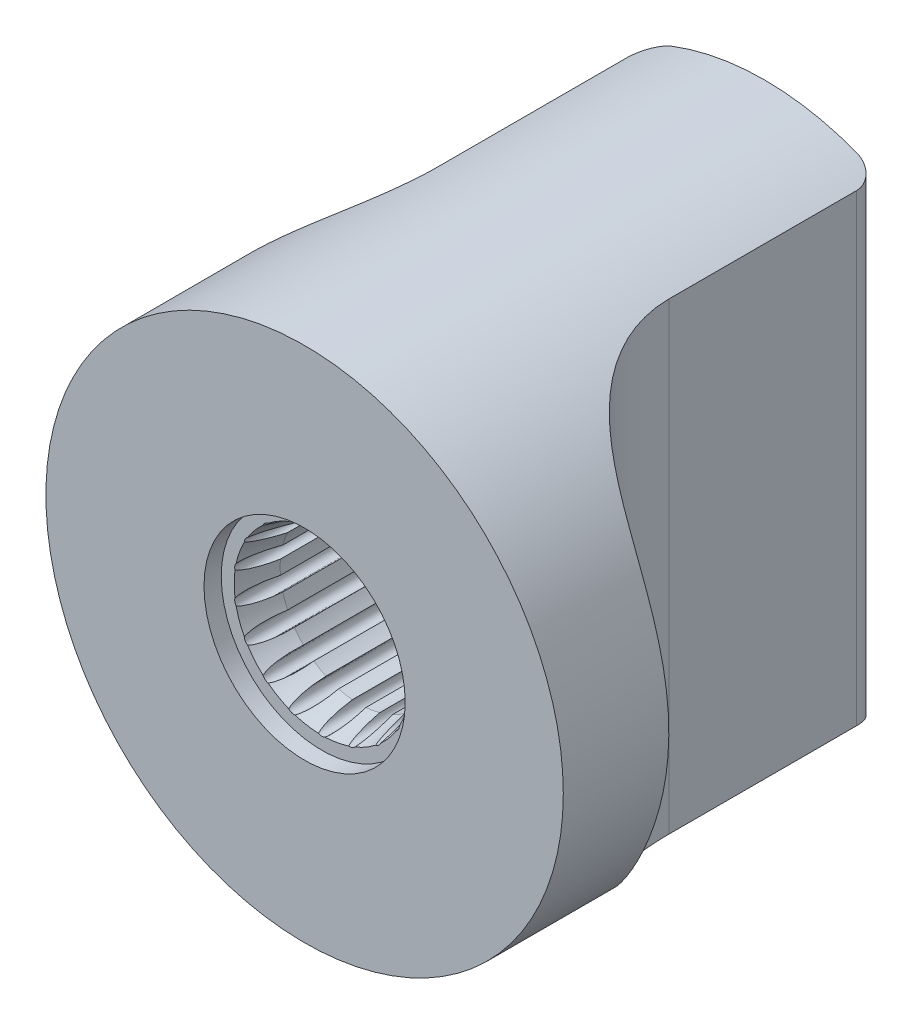
from build123d import *

# Parameters (mm, degrees)
SKETCH1_R                 = 9
BOSS_EXTRUDE1_DEPTH       = 16
PERFIL_LATERAL_DEPTH      = 21.4450483
PERFIL_LATERAL_DEPTH_BACK = 21.4450483
SKETCH2_OUTSIDE_W         = 26.014
SKETCH2_OUTSIDE_H         = 24.014
HUECO_PPAL_DEPTH          = 10.5
SKETCH4_R                 = 3.5
CUT_EXTRUDE4_DEPTH        = 0.6
CHAMFER1_SIZE             = 0.3
CHAMFER1_SIZE2            = 1.299442762
FILLET1_R                 = 0.8


with BuildPart() as part:
    # Sketch1 → Boss-Extrude1 (new body)
    with BuildSketch(Plane.XY):
        Circle(SKETCH1_R)
    extrude(amount=BOSS_EXTRUDE1_DEPTH)

    # Sketch2 outside → Perfil lateral (cut, two sides: drawn at the far end of the back side and taken through both)
    with BuildSketch(Plane(origin=(0, 0, 0), x_dir=(1, 0, 0), z_dir=(0, 1, 0)).offset(-PERFIL_LATERAL_DEPTH_BACK)):
        with Locations((0, -8)):
            Rectangle(SKETCH2_OUTSIDE_W, SKETCH2_OUTSIDE_H)
        with BuildLine():
            Line((4, 0), (-4, 0))
            Line((-4, 0), (-4, -7.328846749))
            ThreePointArc((-4, -7.328846749), (-5.464466094, -10.864380655), (-9, -12.328846749))
            Line((-9, -12.328846749), (-9, -16))
            Line((-9, -16), (9, -16))
            Line((9, -16), (9, -12.328846749))
            ThreePointArc((9, -12.328846749), (5.464466094, -10.864380655), (4, -7.328846749))
            Line((4, -7.328846749), (4, 0))
        make_face(mode=Mode.SUBTRACT)
    extrude(amount=PERFIL_LATERAL_DEPTH + PERFIL_LATERAL_DEPTH_BACK, mode=Mode.SUBTRACT)

    # Sketch3 → Hueco ppal (cut)
    with BuildSketch(Plane.XY.offset(16)):
        with BuildLine():
            ThreePointArc((-1.941278917, 1.947802907), (-2.106622219, 1.767665927), (-2.255310951, 1.573554103))
            ThreePointArc((-2.255310951, 1.573554103), (-2.663028117, 1.5375), (-2.490393303, 1.166379525))
            ThreePointArc((-2.490393303, 1.166379525), (-2.584154707, 0.940555394), (-2.657486258, 0.707295405))
            ThreePointArc((-2.657486258, 0.707295405), (-3.028283841, 0.533968146), (-2.739129502, 0.244273558))
            ThreePointArc((-2.739129502, 0.244273558), (-2.75, 0), (-2.739129502, -0.244273558))
            ThreePointArc((-2.739129502, -0.244273558), (-3.028283841, -0.533968146), (-2.657486258, -0.707295405))
            ThreePointArc((-2.657486258, -0.707295405), (-2.584154707, -0.940555394), (-2.490393303, -1.166379525))
            ThreePointArc((-2.490393303, -1.166379525), (-2.663028117, -1.5375), (-2.255310951, -1.573554103))
            ThreePointArc((-2.255310951, -1.573554103), (-2.106622219, -1.767665927), (-1.941278917, -1.947802907))
            ThreePointArc((-1.941278917, -1.947802907), (-1.9765719, -2.355586663), (-1.581111858, -2.250018954))
            ThreePointArc((-1.581111858, -2.250018954), (-1.375, -2.38156986), (-1.158017644, -2.494292512))
            ThreePointArc((-1.158017644, -2.494292512), (-1.051711941, -2.889554809), (-0.71620734, -2.655098312))
            ThreePointArc((-0.71620734, -2.655098312), (-0.477532489, -2.708221321), (-0.235082352, -2.739933628))
            ThreePointArc((-0.235082352, -2.739933628), (0, -3.075), (0.235082352, -2.739933628))
            ThreePointArc((0.235082352, -2.739933628), (0.477532489, -2.708221321), (0.71620734, -2.655098312))
            ThreePointArc((0.71620734, -2.655098312), (1.051711941, -2.889554809), (1.158017644, -2.494292512))
            ThreePointArc((1.158017644, -2.494292512), (1.375, -2.38156986), (1.581111858, -2.250018954))
            ThreePointArc((1.581111858, -2.250018954), (1.9765719, -2.355586663), (1.941278917, -1.947802907))
            ThreePointArc((1.941278917, -1.947802907), (2.106622219, -1.767665927), (2.255310951, -1.573554103))
            ThreePointArc((2.255310951, -1.573554103), (2.663028117, -1.5375), (2.490393303, -1.166379525))
            ThreePointArc((2.490393303, -1.166379525), (2.584154707, -0.940555394), (2.657486258, -0.707295405))
            ThreePointArc((2.657486258, -0.707295405), (3.028283841, -0.533968146), (2.739129502, -0.244273558))
            ThreePointArc((2.739129502, -0.244273558), (2.75, 0), (2.739129502, 0.244273558))
            ThreePointArc((2.739129502, 0.244273558), (3.028283841, 0.533968146), (2.657486258, 0.707295405))
            ThreePointArc((2.657486258, 0.707295405), (2.584154707, 0.940555394), (2.490393303, 1.166379525))
            ThreePointArc((2.490393303, 1.166379525), (2.663028117, 1.5375), (2.255310951, 1.573554103))
            ThreePointArc((2.255310951, 1.573554103), (2.106622219, 1.767665927), (1.941278917, 1.947802907))
            ThreePointArc((1.941278917, 1.947802907), (1.9765719, 2.355586663), (1.581111858, 2.250018954))
            ThreePointArc((1.581111858, 2.250018954), (1.375, 2.38156986), (1.158017644, 2.494292512))
            ThreePointArc((1.158017644, 2.494292512), (1.051711941, 2.889554809), (0.71620734, 2.655098312))
            ThreePointArc((0.71620734, 2.655098312), (0.477532489, 2.708221321), (0.235082352, 2.739933628))
            ThreePointArc((0.235082352, 2.739933628), (0, 3.075), (-0.235082352, 2.739933628))
            ThreePointArc((-0.235082352, 2.739933628), (-0.477532489, 2.708221321), (-0.71620734, 2.655098312))
            ThreePointArc((-0.71620734, 2.655098312), (-1.051711941, 2.889554809), (-1.158017644, 2.494292512))
            ThreePointArc((-1.158017644, 2.494292512), (-1.375, 2.38156986), (-1.581111858, 2.250018954))
            ThreePointArc((-1.581111858, 2.250018954), (-1.9765719, 2.355586663), (-1.941278917, 1.947802907))
        make_face()
    extrude(amount=-HUECO_PPAL_DEPTH, mode=Mode.SUBTRACT)

    # Sketch4 → Cut-Extrude4 (cut)
    with BuildSketch(Plane.XY.offset(16)):
        Circle(SKETCH4_R)
    extrude(amount=-CUT_EXTRUDE4_DEPTH, mode=Mode.SUBTRACT)

    # Chamfer1
    chamfer1_edges = [part.edges().sort_by_distance(p)[0] for p in [
        (-2.106622219, 1.767665927, 15.4),
        (-1.375, 2.38156986, 15.4),
        (-0.477532489, 2.708221321, 15.4),
        (0.477532489, 2.708221321, 15.4),
        (1.375, 2.38156986, 15.4),
        (2.106622219, 1.767665927, 15.4),
        (2.584154707, 0.940555394, 15.4),
        (2.75, 0, 15.4),
        (2.584154707, -0.940555394, 15.4),
        (2.106622219, -1.767665927, 15.4),
        (1.375, -2.38156986, 15.4),
        (0.477532489, -2.708221321, 15.4),
        (-0.477532489, -2.708221321, 15.4),
        (-1.375, -2.38156986, 15.4),
        (-2.106622219, -1.767665927, 15.4),
        (-2.584154707, -0.940555394, 15.4),
        (-2.75, 0, 15.4),
        (-2.584154707, 0.940555394, 15.4),
    ]]
    chamfer1_side = [part.faces().sort_by_distance(p)[0] for p in [
        (-3.401005051, 0, 15.4),
    ]]
    chamfer(chamfer1_edges, length=CHAMFER1_SIZE, length2=CHAMFER1_SIZE2, reference=chamfer1_side[0])

    # Fillet1
    fillet1_edges = [part.edges().sort_by_distance(p)[0] for p in [
        (-4, 0, 0),
        (4, 0, 0),
    ]]
    fillet(fillet1_edges, radius=FILLET1_R)


solid = part.part
